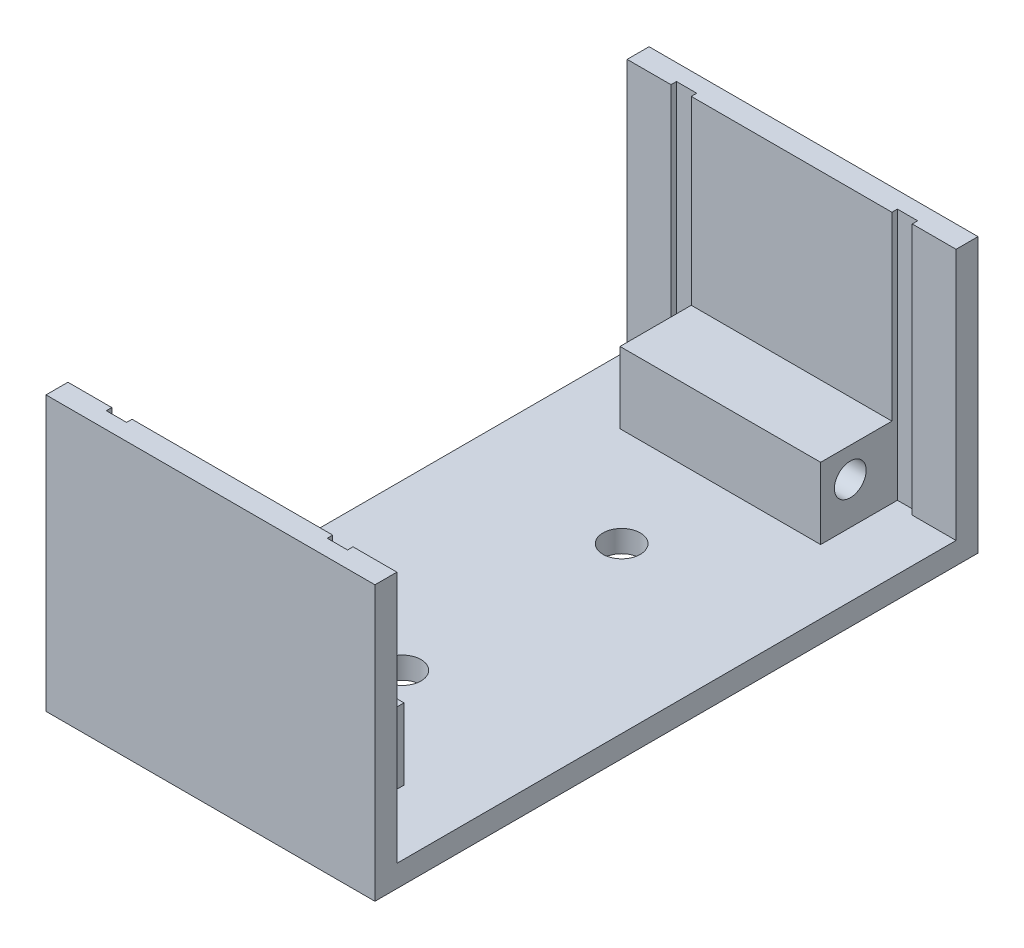
from build123d import *

# Parameters (mm, degrees)
BOSS_EXTRUDE1_DEPTH   = 25
BOSS_EXTRUDE1_2_DEPTH = 25
BOSS_EXTRUDE2_DEPTH   = 2
SKETCH2_W             = 18.3
SKETCH2_H             = 6.5
BOSS_EXTRUDE3_DEPTH   = 6.5
CUT_EXTRUDE1_REACH    = 46.322
SKETCH3_R             = 1.45
CUT_EXTRUDE3_REACH    = 40.862
SKETCH4_R             = 1.7


with BuildPart() as part:
    # Sketch1 → Boss-Extrude1 (new body)
    with BuildSketch(Plane(origin=(0, 0, 0), x_dir=(1, 0, 0), z_dir=(0, 1, 0))):
        Polygon((15, 27.5), (-15, 27.5), (-15, 25.5), (-11, 25.5), (-11, 26), (-9.15, 26), (-9.15, 25.5), (9.15, 25.5), (9.15, 26), (11, 26), (11, 25.5), (15, 25.5), align=None)
    extrude(amount=BOSS_EXTRUDE1_DEPTH)



with BuildPart() as body_2:
    # Sketch1 → Boss-Extrude1 2 (new body)
    with BuildSketch(Plane(origin=(0, 0, 0), x_dir=(1, 0, 0), z_dir=(0, 1, 0))):
        Polygon((-11, -25.5), (-15, -25.5), (-15, -27.5), (15, -27.5), (15, -25.5), (11, -25.5), (11, -26), (9.15, -26), (9.15, -25.5), (-9.15, -25.5), (-9.15, -26), (-11, -26), align=None)
    extrude(amount=BOSS_EXTRUDE1_2_DEPTH)


with BuildPart() as part_1:
    add(part.part)

    add(body_2.part)  # Boss-Extrude2 merges body 2
    # Sketch1<3> → Boss-Extrude2 (add)
    with BuildSketch(Plane(origin=(0, 0, 0), x_dir=(1, 0, 0), z_dir=(0, 1, 0))):
        Polygon((-11, 25.5), (-15, 25.5), (-15, -25.5), (-11, -25.5), (-11, -26), (-9.15, -26), (-9.15, -25.5), (9.15, -25.5), (9.15, -26), (11, -26), (11, -25.5), (15, -25.5), (15, 25.5), (11, 25.5), (11, 26), (9.15, 26), (9.15, 25.5), (-9.15, 25.5), (-9.15, 26), (-11, 26), align=None)
    extrude(amount=BOSS_EXTRUDE2_DEPTH)

    # Sketch2 → Boss-Extrude3 (add)
    with BuildSketch(Plane(origin=(0, 2, 0), x_dir=(1, 0, 0), z_dir=(0, 1, 0))):
        with Locations((0, -22.25)):
            Rectangle(SKETCH2_W, SKETCH2_H)
    boss_extrude3 = extrude(amount=BOSS_EXTRUDE3_DEPTH)

    # Sketch3 → Cut-Extrude1 (cut, up to next)
    with BuildSketch(Plane(origin=(9.15, 0, 0), x_dir=(0, 0, -1), z_dir=(1, 0, 0)), mode=Mode.PRIVATE) as cut_extrude1_sk1:
        with Locations((-21.7, 5.8)):
            Circle(SKETCH3_R)
    cut_extrude1_tool1 = extrude(cut_extrude1_sk1.sketch, amount=-CUT_EXTRUDE1_REACH, mode=Mode.PRIVATE) & part_1.part
    cut_extrude1 = cut_extrude1_tool1.solids().sort_by_distance((9.15, 5.8, 21.7))[0]
    add(cut_extrude1, mode=Mode.SUBTRACT)

    # Sketch4 → Cut-Extrude3 (cut, up to next)
    with BuildSketch(Plane(origin=(0, 2, 0), x_dir=(1, 0, 0), z_dir=(0, 1, 0)), mode=Mode.PRIVATE) as cut_extrude3_sk1:
        with Locations((0, 10)):
            Circle(SKETCH4_R)
    cut_extrude3_tool1 = extrude(cut_extrude3_sk1.sketch, amount=-CUT_EXTRUDE3_REACH, mode=Mode.PRIVATE) & part_1.part
    # Sketch4 → Cut-Extrude3 (cut, up to next)
    with BuildSketch(Plane(origin=(0, 2, 0), x_dir=(1, 0, 0), z_dir=(0, 1, 0)), mode=Mode.PRIVATE) as cut_extrude3_sk2:
        with Locations((0, -10)):
            Circle(SKETCH4_R)
    cut_extrude3_tool2 = extrude(cut_extrude3_sk2.sketch, amount=-CUT_EXTRUDE3_REACH, mode=Mode.PRIVATE) & part_1.part
    add(cut_extrude3_tool1.solids().sort_by_distance((0, 2, -10))[0], mode=Mode.SUBTRACT)
    add(cut_extrude3_tool2.solids().sort_by_distance((0, 2, 10))[0], mode=Mode.SUBTRACT)

    # Mirror1: Boss-Extrude3, Cut-Extrude1 across plane
    add(boss_extrude3.mirror(Plane.XY))
    add(cut_extrude1.mirror(Plane.XY), mode=Mode.SUBTRACT)


solid = part_1.part
